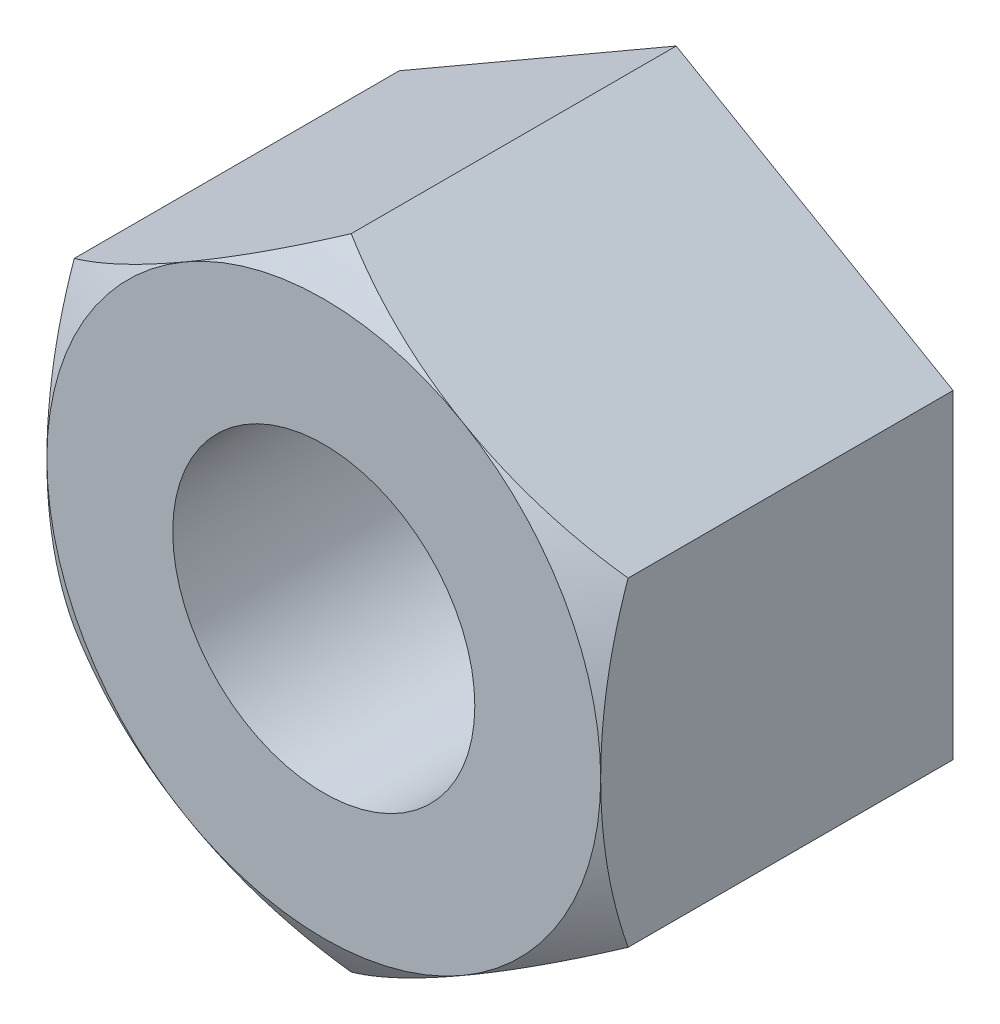
from build123d import *

# Parameters (mm, degrees)
SKETCH_1_R      = 1.5
EXTRUDE_1_DEPTH = 3.5


with BuildPart() as part:
    # ｽｹｯﾁ1 → ﾎﾞｽ - 押し出し1 (new body)
    with BuildSketch(Plane.XY):
        Polygon((0, 3.175426481), (-2.75, 1.58771324), (-2.75, -1.58771324), (0, -3.175426481), (2.75, -1.58771324), (2.75, 1.58771324), align=None)
        Circle(SKETCH_1_R, mode=Mode.SUBTRACT)
    extrude(amount=EXTRUDE_1_DEPTH)

    # ｽｹｯﾁ5 → ｶｯﾄ - 回転2 (revolve, cut)
    with BuildSketch(Plane(origin=(0, 0, 0), x_dir=(0, 0, -1), z_dir=(1, 0, 0))):
        with BuildLine():
            Line((-3.227591474, 3.175426481), (-3.5, 3.175426481))
            Line((-3.5, 3.175426481), (-3.5, 2.75))
            ThreePointArc((-3.5, 2.75), (-3.368682669, 2.965842434), (-3.227591474, 3.175426481))
        make_face()
    revolve(axis=Axis((0, 0, 0), (0, 0, 1)), mode=Mode.SUBTRACT)


solid = part.part
